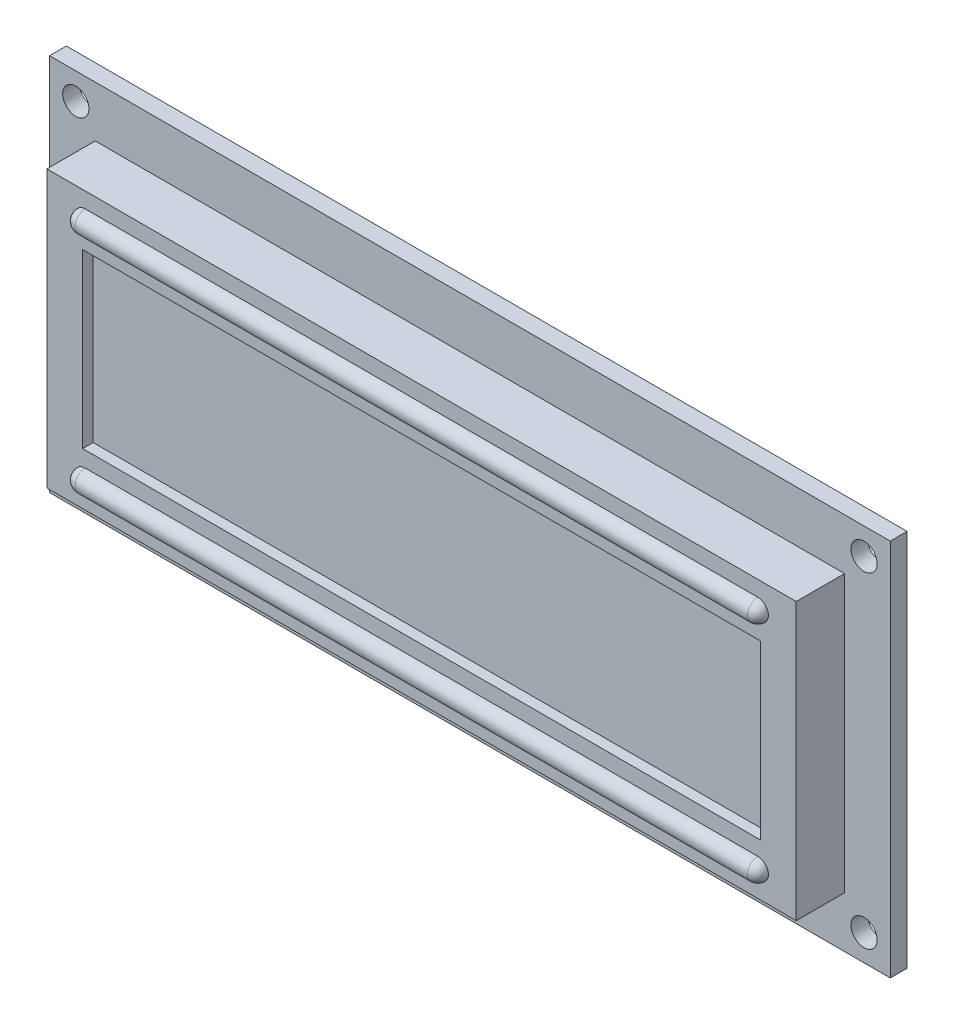
from build123d import *

# Parameters (mm, degrees)
CROQUIS1_W              = 80
CROQUIS1_H              = 36
CROQUIS1_R              = 1.25
SALIENTE_EXTRUIR2_DEPTH = 1.6
CROQUIS2_W              = 71.3
CROQUIS2_H              = 26.3
SALIENTE_EXTRUIR3_DEPTH = 4.6
CROQUIS3_W              = 64.5
CROQUIS3_H              = 16.4
CORTAR_EXTRUIR1_DEPTH   = 1
CROQUIS5_R              = 1
SALIENTE_EXTRUIR4_DEPTH = 32
REVOLUCI_N3_ANGLE       = 90


with BuildPart() as part:
    # Croquis1 → Saliente-Extruir2 (new body)
    with BuildSketch(Plane.XY):
        with Locations((40, 18)):
            Rectangle(CROQUIS1_W, CROQUIS1_H)
        with Locations((77.5, 33.5)):
            Circle(CROQUIS1_R, mode=Mode.SUBTRACT)
        with Locations((77.5, 2.5)):
            Circle(CROQUIS1_R, mode=Mode.SUBTRACT)
        with Locations((2.5, 2.5)):
            Circle(CROQUIS1_R, mode=Mode.SUBTRACT)
        with Locations((2.5, 33.5)):
            Circle(CROQUIS1_R, mode=Mode.SUBTRACT)
    extrude(amount=SALIENTE_EXTRUIR2_DEPTH)

    # Croquis2 → Saliente-Extruir3 (add)
    with BuildSketch(Plane.XY.offset(1.6)):
        with Locations((40, 18)):
            Rectangle(CROQUIS2_W, CROQUIS2_H)
    extrude(amount=SALIENTE_EXTRUIR3_DEPTH)

    # Croquis3 → Cortar-Extruir1 (cut)
    with BuildSketch(Plane.XY.offset(6.2)):
        with Locations((40, 18)):
            Rectangle(CROQUIS3_W, CROQUIS3_H)
    extrude(amount=-CORTAR_EXTRUIR1_DEPTH, mode=Mode.SUBTRACT)

    # Croquis5 → Saliente-Extruir4 (add, symmetric)
    with BuildSketch(Plane(origin=(40, 0, 0), x_dir=(0, 0, -1), z_dir=(1, 0, 0))):
        with Locations((-6.2, 28.675)):
            Circle(CROQUIS5_R)
        with Locations((-6.2, 7.325)):
            Circle(CROQUIS5_R)
    extrude(amount=SALIENTE_EXTRUIR4_DEPTH, both=True)

    # Croquis4 → Revolución3 (revolve)
    with BuildSketch(Plane.XY.offset(6.2)):
        with BuildLine():
            Line((72, 29.675), (72, 27.675))
            ThreePointArc((72, 27.675), (73, 28.675), (72, 29.675))
        make_face()
    revolve(axis=Axis((72, 29.675, 6.2), (0, -1, 0)), revolution_arc=REVOLUCI_N3_ANGLE)

    # Croquis6 → Revolución4 (revolve)
    with BuildSketch(Plane.XY.offset(6.2)):
        with BuildLine():
            Line((8, 29.675), (8, 27.675))
            ThreePointArc((8, 27.675), (7, 28.675), (8, 29.675))
        make_face()
    revolve(axis=Axis((8, 29.675, 6.2), (0, -1, 0)))

    # Croquis7 → Revolución5 (revolve)
    with BuildSketch(Plane.XY.offset(6.2)):
        with BuildLine():
            Line((8, 8.325), (8, 6.325))
            ThreePointArc((8, 6.325), (7, 7.325), (8, 8.325))
        make_face()
    revolve(axis=Axis((8, 8.325, 6.2), (0, -1, 0)))

    # Croquis8 → Revolución6 (revolve)
    with BuildSketch(Plane.XY.offset(6.2)):
        with BuildLine():
            Line((72, 8.325), (72, 6.325))
            ThreePointArc((72, 6.325), (73, 7.325), (72, 8.325))
        make_face()
    revolve(axis=Axis((72, 8.325, 6.2), (0, -1, 0)))


solid = part.part
